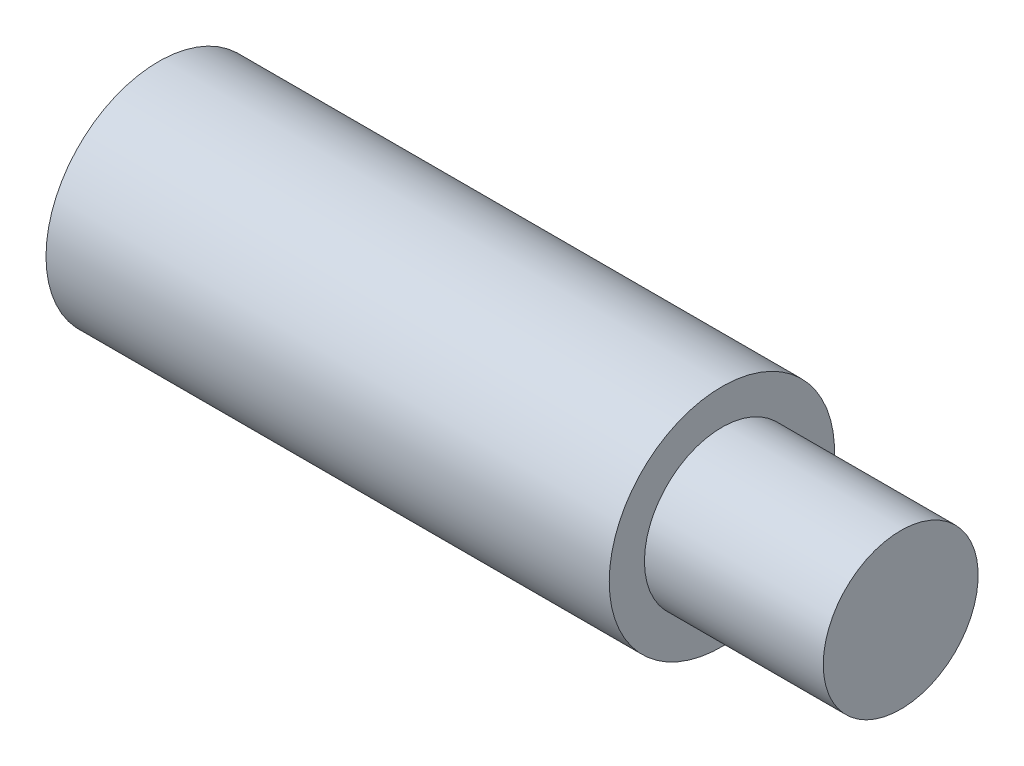
from build123d import *


with BuildPart() as part:
    # Fill_QC4 Sketch → Fill_QC4 (revolve)
    with BuildSketch(Plane.XY):
        Polygon((12.7, 0), (12.7, 5.5), (0, 5.5), (0, 8), (-40, 8), (-40, 0), align=None)
    revolve(axis=Axis((-1000, 0, 0), (1, 0, 0)))


solid = part.part
